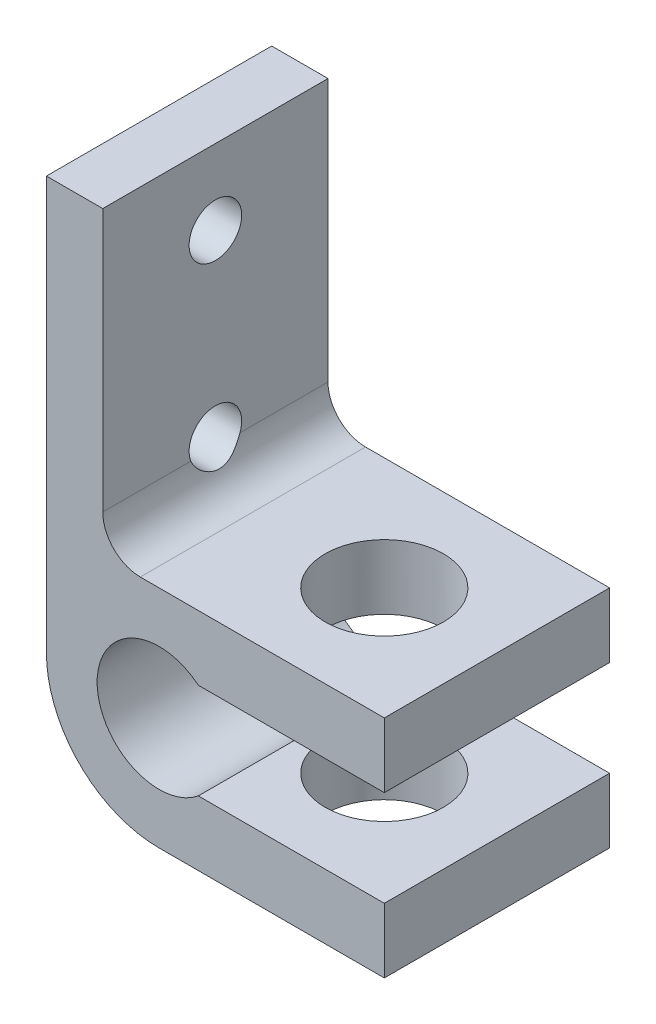
from build123d import *

# Parameters (mm, degrees)
BOSS_EXTRUDE1_DEPTH     = 12
CUT_EXTRUDE1_DEPTH      = 28.784887979
CUT_EXTRUDE1_DEPTH_BACK = 28.784887979
SKETCH2_R               = 3.15
CUT_EXTRUDE2_REACH      = 32.854
SKETCH3_R               = 1.4


with BuildPart() as part:
    # Sketch1 → Boss-Extrude1 (new body)
    with BuildSketch(Plane.XY):
        with BuildLine():
            Line((-1, 6), (12, 6))
            Line((12, 6), (12, 2.552710574))
            Line((12, 2.552710574), (2.091331807, 2.552710574))
            ThreePointArc((2.091331807, 2.552710574), (-3.3, 0), (2.091331807, -2.552710574))
            Line((2.091331807, -2.552710574), (12, -2.552710574))
            Line((12, -2.552710574), (12, -6))
            Line((12, -6), (0, -6))
            ThreePointArc((0, -6), (-4.242640687, -4.242640687), (-6, 0))
            Line((-6, 0), (-6, 22))
            Line((-6, 22), (-3, 22))
            Line((-3, 22), (-3, 8))
            ThreePointArc((-3, 8), (-2.414213562, 6.585786438), (-1, 6))
        make_face()
    extrude(amount=BOSS_EXTRUDE1_DEPTH)

    # Sketch2 → Cut-Extrude1 (cut, two sides: drawn at the far end of the back side and taken through both)
    with BuildSketch(Plane(origin=(0, 0, 0), x_dir=(1, 0, 0), z_dir=(0, 1, 0)).offset(-CUT_EXTRUDE1_DEPTH_BACK)):
        with Locations(Location((6, -6, 0), (0, 0, 270))):
            Circle(SKETCH2_R)
    extrude(amount=CUT_EXTRUDE1_DEPTH + CUT_EXTRUDE1_DEPTH_BACK, mode=Mode.SUBTRACT)

    # Sketch3 → Cut-Extrude2 (cut, up to next)
    with BuildSketch(Plane.ZY.offset(6), mode=Mode.PRIVATE) as cut_extrude2_sk1:
        with Locations((6, 18)):
            Circle(SKETCH3_R)
    cut_extrude2_tool1 = extrude(cut_extrude2_sk1.sketch, amount=-CUT_EXTRUDE2_REACH, mode=Mode.PRIVATE) & part.part
    # Sketch3 → Cut-Extrude2 (cut, up to next)
    with BuildSketch(Plane.ZY.offset(6), mode=Mode.PRIVATE) as cut_extrude2_sk2:
        with Locations((6, 8.5)):
            Circle(SKETCH3_R)
    cut_extrude2_tool2 = extrude(cut_extrude2_sk2.sketch, amount=-CUT_EXTRUDE2_REACH, mode=Mode.PRIVATE) & part.part
    add(cut_extrude2_tool1.solids().sort_by_distance((-6, 18, 6))[0], mode=Mode.SUBTRACT)
    add(cut_extrude2_tool2.solids().sort_by_distance((-6, 8.5, 6))[0], mode=Mode.SUBTRACT)


solid = part.part
